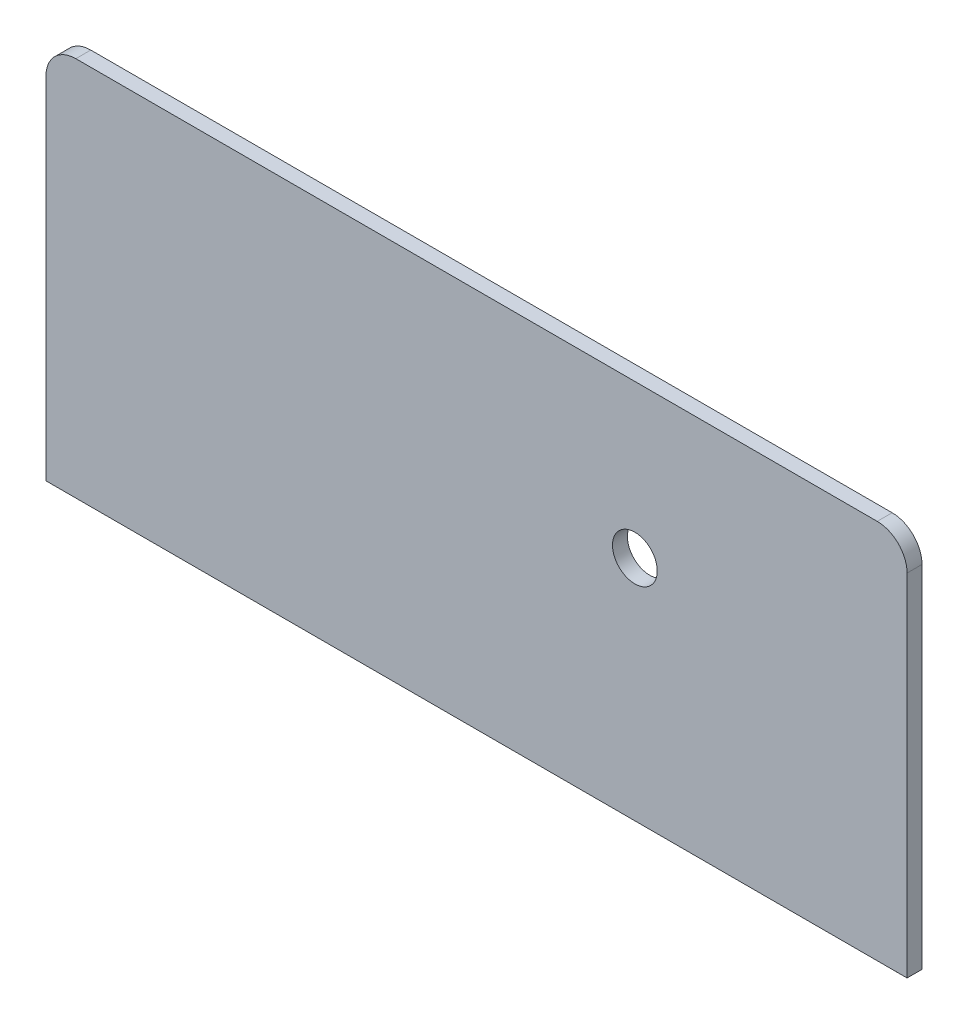
from build123d import *

# Parameters (mm, degrees)
SKETCH1_R           = 1.5
BOSS_EXTRUDE1_DEPTH = 1


with BuildPart() as part:
    # Sketch1 → Boss-Extrude1 (new body)
    with BuildSketch(Plane.XY):
        with BuildLine():
            Line((8.1, 39), (-49.6, 39))
            Line((-49.6, 39), (-49.6, 62.5))
            ThreePointArc((-49.6, 62.5), (-49.014213562, 63.914213562), (-47.6, 64.5))
            Line((-47.6, 64.5), (6.1, 64.5))
            ThreePointArc((6.1, 64.5), (7.514213562, 63.914213562), (8.1, 62.5))
            Line((8.1, 62.5), (8.1, 39))
        make_face()
        with Locations((-10.14, 54.25)):
            Circle(SKETCH1_R, mode=Mode.SUBTRACT)
    extrude(amount=BOSS_EXTRUDE1_DEPTH)


solid = part.part
